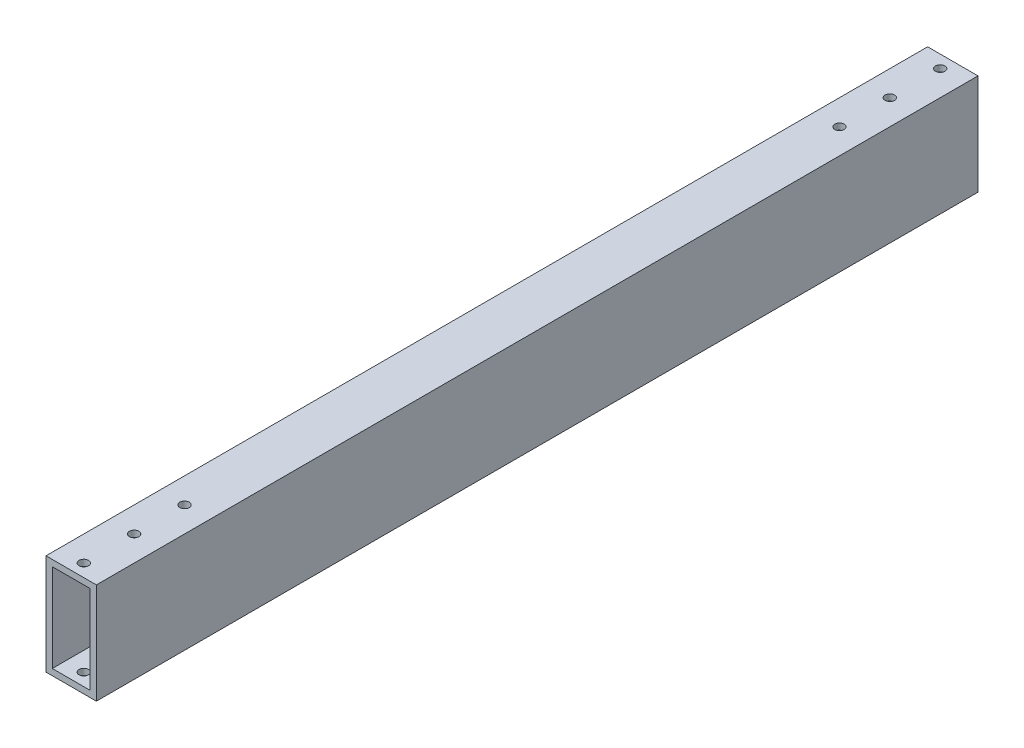
from build123d import *

# Parameters (mm, degrees)
SKETCH1_W           = 25.4
SKETCH1_H           = 50.8
BOSS_EXTRUDE1_DEPTH = 444.5
SHELL1_T            = -3.175
SKETCH2_R           = 2.38125
CUT_EXTRUDE1_DEPTH  = 448.573658742


with BuildPart() as part:
    # Sketch1 → Boss-Extrude1 (new body)
    with BuildSketch(Plane.XY):
        Rectangle(SKETCH1_W, SKETCH1_H)
    extrude(amount=BOSS_EXTRUDE1_DEPTH)

    # Shell1
    shell1_openings = [part.faces().sort_by_distance(p)[0] for p in [
        (0, 0, 444.5),
        (0, 0, 0),
    ]]
    offset(amount=SHELL1_T, openings=shell1_openings, kind=Kind.INTERSECTION)

    # Sketch2 → Cut-Extrude1 (cut, through all)
    with BuildSketch(Plane(origin=(0, 25.4, 0), x_dir=(1, 0, 0), z_dir=(0, 1, 0))):
        with Locations(Location((0, -6.35, 0), (0, 0, 270))):
            Circle(SKETCH2_R)
        with Locations(Location((0, -31.75, 0), (0, 0, 270))):
            Circle(SKETCH2_R)
        with Locations(Location((0, -57.15, 0), (0, 0, 270))):
            Circle(SKETCH2_R)
        with Locations(Location((0, -387.35, 0), (0, 0, 270))):
            Circle(SKETCH2_R)
        with Locations(Location((0, -412.75, 0), (0, 0, 270))):
            Circle(SKETCH2_R)
        with Locations(Location((0, -438.15, 0), (0, 0, 270))):
            Circle(SKETCH2_R)
    extrude(amount=-CUT_EXTRUDE1_DEPTH, mode=Mode.SUBTRACT)


solid = part.part
